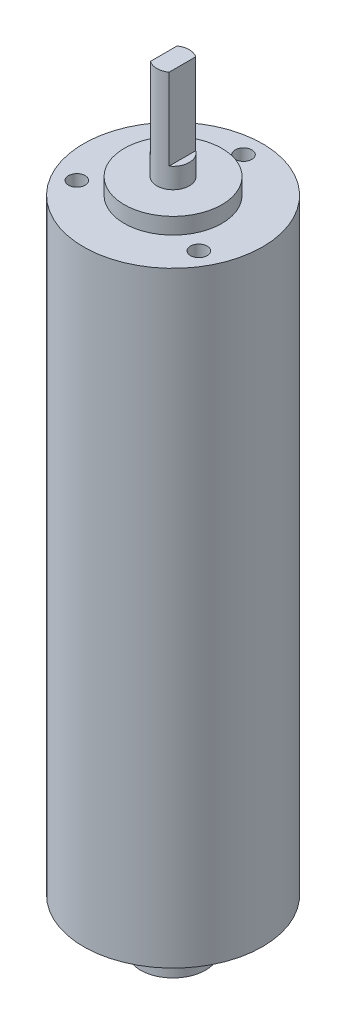
from build123d import *

# Parameters (mm, degrees)
CUT_EXTRUDE_1_DEPTH      = 10
HOLE_WIZARD_M2_5_1_D     = 2.05
HOLE_WIZARD_M2_5_1_DEPTH = 6.35
HOLE_WIZARD_M2_5_1_TIP   = 0.615882135
HOLE_WIZARD_M2_1_D       = 1.6
HOLE_WIZARD_M2_1_DEPTH   = 5.2
HOLE_WIZARD_M2_1_TIP     = 0.480688495


with BuildPart() as part:
    # 草图1 → 旋转1 (revolve)
    with BuildSketch(Plane.XY):
        Polygon((0, 0), (4, 0), (4, 3), (1.5, 3), (1.5, 6), (11, 6), (11, 80.5), (6, 80.5), (6, 82.5), (2, 82.5), (2, 95), (0, 95), align=None)
    revolve(axis=Axis((0, 0, 0), (0, 1, 0)))

    # 草图2 → 切除-拉伸1 (cut)
    with BuildSketch(Plane(origin=(0, 95, 0), x_dir=(1, 0, 0), z_dir=(0, 1, 0))):
        with BuildLine():
            Line((-1.15, -1.636306817), (-1.15, 1.636306817))
            ThreePointArc((-1.15, 1.636306817), (-2, 0), (-1.15, -1.636306817))
        make_face()
        with BuildLine():
            ThreePointArc((2, 0), (1.774823935, 0.921954446), (1.15, 1.636306817))
            Line((1.15, 1.636306817), (1.15, -1.636306817))
            ThreePointArc((1.15, -1.636306817), (1.774823935, -0.921954446), (2, 0))
        make_face()
    extrude(amount=-CUT_EXTRUDE_1_DEPTH, mode=Mode.SUBTRACT)

    # M2.5 螺纹孔1
    with Locations(Plane(origin=(0, 80.5, 0), x_dir=(1, 0, 0), z_dir=(0, 1, 0))):
        with Locations((0, 8.660254038), (-7.5, -4.330127019), (7.5, -4.330127019)):
            Hole(HOLE_WIZARD_M2_5_1_D / 2, depth=HOLE_WIZARD_M2_5_1_DEPTH)
            with Locations((0, 0, -(HOLE_WIZARD_M2_5_1_DEPTH + HOLE_WIZARD_M2_5_1_TIP / 2))):  # 118° drill point
                Cone(0, HOLE_WIZARD_M2_5_1_D / 2, HOLE_WIZARD_M2_5_1_TIP, mode=Mode.SUBTRACT)

    # M2 螺纹孔1
    with Locations(Plane(origin=(0, 6, 0), x_dir=(-1, 0, 0), z_dir=(0, -1, 0))):
        with Locations((-6.5, 0), (6.5, 0)):
            Hole(HOLE_WIZARD_M2_1_D / 2, depth=HOLE_WIZARD_M2_1_DEPTH)
            with Locations((0, 0, -(HOLE_WIZARD_M2_1_DEPTH + HOLE_WIZARD_M2_1_TIP / 2))):  # 118° drill point
                Cone(0, HOLE_WIZARD_M2_1_D / 2, HOLE_WIZARD_M2_1_TIP, mode=Mode.SUBTRACT)


solid = part.part
